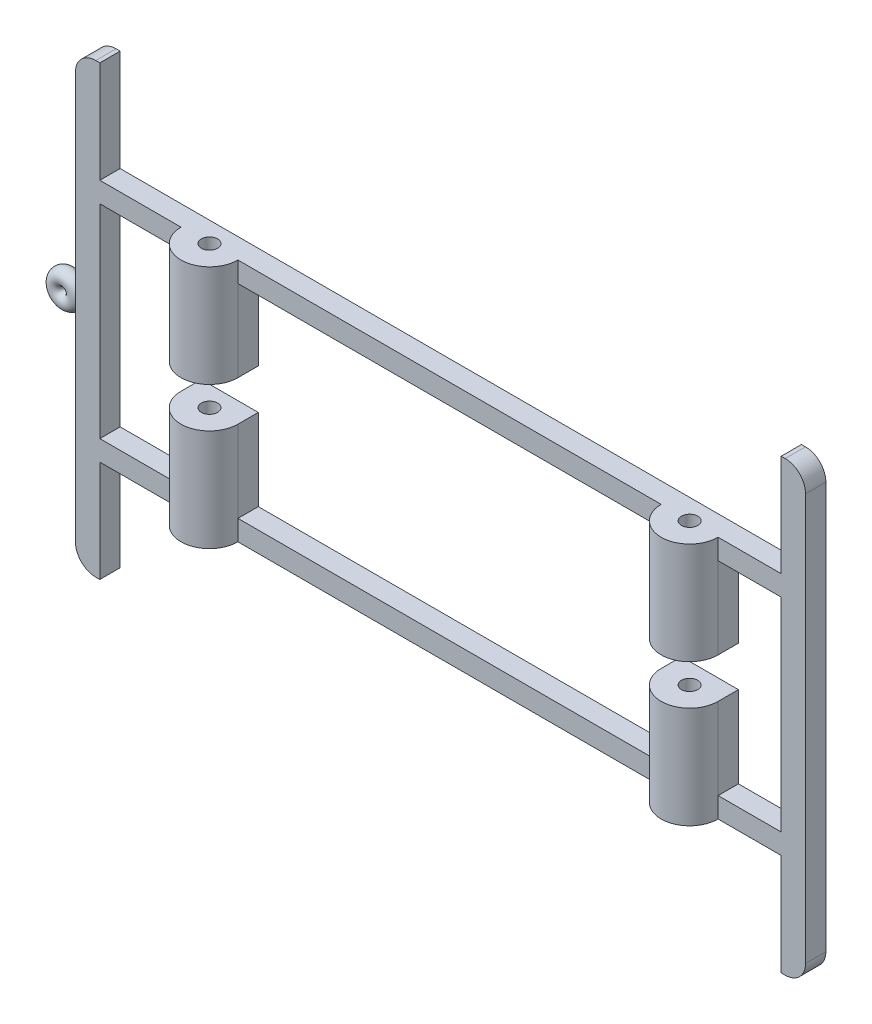
from build123d import *

# Parameters (mm, degrees)
SKETCH1_W           = 167.5
SKETCH1_H           = 50
BOSS_EXTRUDE1_DEPTH = 5
BOSS_EXTRUDE2_REACH = 125.711
SKETCH3_R           = 2
CUT_EXTRUDE1_DEPTH  = 125.190739079
SKETCH6_R           = 1.947134786
BOSS_EXTRUDE7_DEPTH = 2.5
BOSS_EXTRUDE9_REACH = 133.18
SKETCH10_R          = 2
CUT_EXTRUDE3_DEPTH  = 132.180305898
FILLET2_R           = 5
SKETCH11_W          = 132.04
SKETCH11_H          = 9.88782449
CUT_EXTRUDE5_DEPTH  = 36


with BuildPart() as part:
    # Sketch1 → Boss-Extrude1 (new body)
    with BuildSketch(Plane.XY):
        Polygon((-83.75, 30), (-83.75, 55), (-89.745973018, 55), (-89.745973018, -55), (-83.75, -55), (-83.75, -30), (83.75, -30), (83.75, -55), (89.745973018, -55), (89.745973018, 55), (83.75, 55), (83.75, 30), align=None)
        Rectangle(SKETCH1_W, SKETCH1_H, mode=Mode.SUBTRACT)
    extrude(amount=BOSS_EXTRUDE1_DEPTH)

    # Boss-Extrude2: up to this face of the body (flat: up to its plane)
    boss_extrude2_end = Plane(part.part.faces().sort_by_distance((0, -30, 2.5))[0])
    # Sketch2 → Boss-Extrude2 (add, up to the picked face)
    with BuildSketch(Plane(origin=(0, 30, 0), x_dir=(1, 0, 0), z_dir=(0, 1, 0)), mode=Mode.PRIVATE) as boss_extrude2_sk1:
        with BuildLine():
            Line((-56.79, -5), (-63.79, -5))
            ThreePointArc((-63.79, -5), (-56.79, -12), (-49.79, -5))
            Line((-49.79, -5), (-56.79, -5))
        make_face()
    boss_extrude2_tool1 = split(extrude(boss_extrude2_sk1.sketch, amount=-BOSS_EXTRUDE2_REACH, mode=Mode.PRIVATE), bisect_by=boss_extrude2_end, keep=Keep.BOTH, mode=Mode.PRIVATE)
    # Sketch2 → Boss-Extrude2 (add, up to the picked face)
    with BuildSketch(Plane(origin=(0, 30, 0), x_dir=(1, 0, 0), z_dir=(0, 1, 0)), mode=Mode.PRIVATE) as boss_extrude2_sk2:
        Polygon((-63.79, 0), (-63.79, -5), (-56.79, -5), (-49.79, -5), (-49.79, 0), align=None)
    boss_extrude2_tool2 = split(extrude(boss_extrude2_sk2.sketch, amount=-BOSS_EXTRUDE2_REACH, mode=Mode.PRIVATE), bisect_by=boss_extrude2_end, keep=Keep.BOTH, mode=Mode.PRIVATE)
    add(boss_extrude2_tool1.solids().sort_by(Axis((-56.79, 30, 7.970892), (0, -1, 0)))[0])
    add(boss_extrude2_tool2.solids().sort_by(Axis((-56.79, 30, 2.5), (0, -1, 0)))[0])

    # Sketch3 → Cut-Extrude1 (cut, through all)
    with BuildSketch(Plane(origin=(0, 30, 0), x_dir=(1, 0, 0), z_dir=(0, 1, 0))):
        with Locations(Location((-56.79, -5, 0), (0, 0, 270))):
            Circle(SKETCH3_R)
    extrude(amount=-CUT_EXTRUDE1_DEPTH, mode=Mode.SUBTRACT)



with BuildPart() as body_2:
    # Sketch6 → Revolve2 (revolve)
    with BuildSketch(Plane(origin=(0, 0, 0), x_dir=(1, 0, 0), z_dir=(0, 1, 0))):
        with Locations((-97.245973018, -1.947134786)):
            Circle(SKETCH6_R)
    revolve(axis=Axis((-94.745973018, 0, 0), (0, 0, 1)))


with BuildPart() as part_1:
    add(part.part)

    add(body_2.part)  # Boss-Extrude7 merges body 2
    # Sketch9 → Boss-Extrude7 (add, symmetric)
    with BuildSketch(Plane(origin=(0, 0, 0), x_dir=(1, 0, 0), z_dir=(0, 1, 0))):
        Polygon((-92.245973018, 0), (-89.745973018, 0), (-89.745973018, -5), align=None)
    extrude(amount=BOSS_EXTRUDE7_DEPTH, both=True)

    # Boss-Extrude9: up to this face of the body (flat: up to its plane)
    boss_extrude9_end = Plane(part_1.part.faces().sort_by_distance((-4.055234189, -30, 2.93205693))[0])
    # Sketch4 → Boss-Extrude9 (add, up to the picked face)
    with BuildSketch(Plane(origin=(0, 30, 0), x_dir=(1, 0, 0), z_dir=(0, 1, 0)), mode=Mode.PRIVATE) as boss_extrude9_sk1:
        with BuildLine():
            Line((68.25, 0), (68.25, -5))
            ThreePointArc((68.25, -5), (61.25, -12), (54.25, -5))
            Line((54.25, -5), (54.25, 0))
            Line((54.25, 0), (68.25, 0))
        make_face()
    boss_extrude9_tool1 = split(extrude(boss_extrude9_sk1.sketch, amount=-BOSS_EXTRUDE9_REACH, mode=Mode.PRIVATE), bisect_by=boss_extrude9_end, keep=Keep.BOTH, mode=Mode.PRIVATE)
    add(boss_extrude9_tool1.solids().sort_by(Axis((61.25, 30, 5.365156), (0, -1, 0)))[0])

    # Sketch10 → Cut-Extrude3 (cut, through all)
    with BuildSketch(Plane(origin=(0, 30, 0), x_dir=(1, 0, 0), z_dir=(0, 1, 0))):
        with Locations(Location((61.25, -5, 0), (0, 0, 270))):
            Circle(SKETCH10_R)
    extrude(amount=-CUT_EXTRUDE3_DEPTH, mode=Mode.SUBTRACT)

    # Fillet2
    fillet2_edges = [part_1.edges().sort_by_distance(p)[0] for p in [
        (89.745973018, -55, 2.5),
        (89.745973018, 55, 2.5),
        (-89.745973018, 55, 2.5),
        (-89.745973018, -55, 2.5),
    ]]
    fillet(fillet2_edges, radius=FILLET2_R)

    # Sketch11 → Cut-Extrude5 (cut)
    with BuildSketch(Plane(origin=(0, 0, 0), x_dir=(-1, 0, 0), z_dir=(0, 0, -1))):
        with Locations((-2.23, 0)):
            Rectangle(SKETCH11_W, SKETCH11_H)
    extrude(amount=-CUT_EXTRUDE5_DEPTH, mode=Mode.SUBTRACT)


solid = part_1.part
